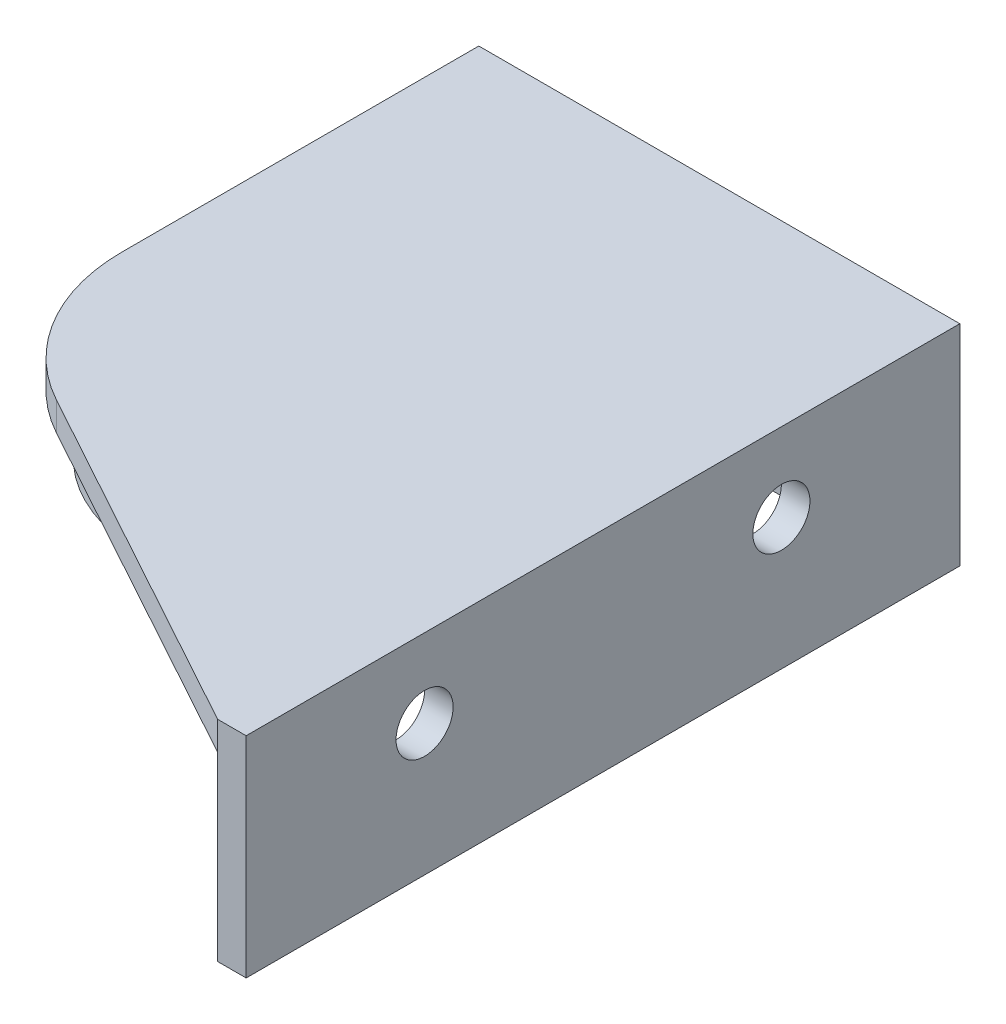
from build123d import *

# Parameters (mm, degrees)
SKETCH2_W                    = 33.7
SKETCH2_H                    = 50
BOSS_EXTRUDE1_DEPTH          = 2
BOSS_EXTRUDE2_DEPTH          = 12.7
CUT_EXTRUDE1_REACH           = 45.84
SKETCH4_R                    = 2
SKETCH5_R                    = 11.5
SKETCH5_R_2                  = 5.5
BOSS_EXTRUDE3_DEPTH          = 4.1
CUT_EXTRUDE_THIN1_DEPTH      = 34.541206001
CUT_EXTRUDE_THIN1_DEPTH_BACK = 8.2
CUT_EXTRUDE2_REACH           = 54.433
SKETCH7_R                    = 2


with BuildPart() as part:
    # Sketch2 → Boss-Extrude1 (new body)
    with BuildSketch(Plane(origin=(0, 0, 0), x_dir=(1, 0, 0), z_dir=(0, 1, 0))):
        Rectangle(SKETCH2_W, SKETCH2_H)
    extrude(amount=BOSS_EXTRUDE1_DEPTH)

    # Sketch3 → Boss-Extrude2 (add)
    with BuildSketch(Plane.XZ):
        Polygon((14.85, 25), (14.85, -23), (-16.85, -23), (-16.85, -25), (16.85, -25), (16.85, 25), align=None)
    extrude(amount=BOSS_EXTRUDE2_DEPTH)

    # Sketch4 → Cut-Extrude1 (cut, up to next)
    with BuildSketch(Plane(origin=(16.85, 0, 0), x_dir=(0, 0, -1), z_dir=(1, 0, 0)), mode=Mode.PRIVATE) as cut_extrude1_sk1:
        with Locations((12.5, -3.5)):
            Circle(SKETCH4_R)
    cut_extrude1_tool1 = extrude(cut_extrude1_sk1.sketch, amount=-CUT_EXTRUDE1_REACH, mode=Mode.PRIVATE) & part.part
    # Sketch4 → Cut-Extrude1 (cut, up to next)
    with BuildSketch(Plane(origin=(16.85, 0, 0), x_dir=(0, 0, -1), z_dir=(1, 0, 0)), mode=Mode.PRIVATE) as cut_extrude1_sk2:
        with Locations((-12.5, -3.5)):
            Circle(SKETCH4_R)
    cut_extrude1_tool2 = extrude(cut_extrude1_sk2.sketch, amount=-CUT_EXTRUDE1_REACH, mode=Mode.PRIVATE) & part.part
    add(cut_extrude1_tool1.solids().sort_by_distance((16.85, -3.5, -12.5))[0], mode=Mode.SUBTRACT)
    add(cut_extrude1_tool2.solids().sort_by_distance((16.85, -3.5, 12.5))[0], mode=Mode.SUBTRACT)

    # Sketch5 → Boss-Extrude3 (add)
    with BuildSketch(Plane.XZ):
        with Locations(Location((-4, 0, 0), (0, 0, 90))):
            Circle(SKETCH5_R)
        with Locations(Location((-4, 0, 0), (0, 0, 270))):
            Circle(SKETCH5_R_2, mode=Mode.SUBTRACT)
    extrude(amount=BOSS_EXTRUDE3_DEPTH)

    # Sketch6 → Cut-Extrude-Thin1 (cut, two sides: drawn at the far end of the back side and taken through both)
    with BuildSketch(Plane(origin=(0, 2, 0), x_dir=(1, 0, 0), z_dir=(0, 1, 0)).offset(-CUT_EXTRUDE_THIN1_DEPTH_BACK)):
        with BuildLine():
            ThreePointArc((-16.85, 0), (-15.057855322, -6.545711243), (-10.181309623, -11.265607456))
            Line((-10.181309623, -11.265607456), (14.85, -25))
            Line((14.85, -25), (5.229284634, -42.534019386))
            Line((5.229284634, -42.534019386), (-19.802024989, -28.799626842))
            ThreePointArc((-19.802024989, -28.799626842), (-32.268525084, -16.733588663), (-36.85, 0))
            Line((-36.85, 0), (-16.85, 0))
        make_face()
    extrude(amount=CUT_EXTRUDE_THIN1_DEPTH + CUT_EXTRUDE_THIN1_DEPTH_BACK, mode=Mode.SUBTRACT)

    # Sketch7 → Cut-Extrude2 (cut, up to next)
    with BuildSketch(Plane.XY.offset(-23), mode=Mode.PRIVATE) as cut_extrude2_sk1:
        with Locations((-9.85, -6.35)):
            Circle(SKETCH7_R)
    cut_extrude2_tool1 = extrude(cut_extrude2_sk1.sketch, amount=-CUT_EXTRUDE2_REACH, mode=Mode.PRIVATE) & part.part
    # Sketch7 → Cut-Extrude2 (cut, up to next)
    with BuildSketch(Plane.XY.offset(-23), mode=Mode.PRIVATE) as cut_extrude2_sk2:
        with Locations((7.85, -6.35)):
            Circle(SKETCH7_R)
    cut_extrude2_tool2 = extrude(cut_extrude2_sk2.sketch, amount=-CUT_EXTRUDE2_REACH, mode=Mode.PRIVATE) & part.part
    add(cut_extrude2_tool1.solids().sort_by_distance((-9.85, -6.35, -23))[0], mode=Mode.SUBTRACT)
    add(cut_extrude2_tool2.solids().sort_by_distance((7.85, -6.35, -23))[0], mode=Mode.SUBTRACT)


solid = part.part
